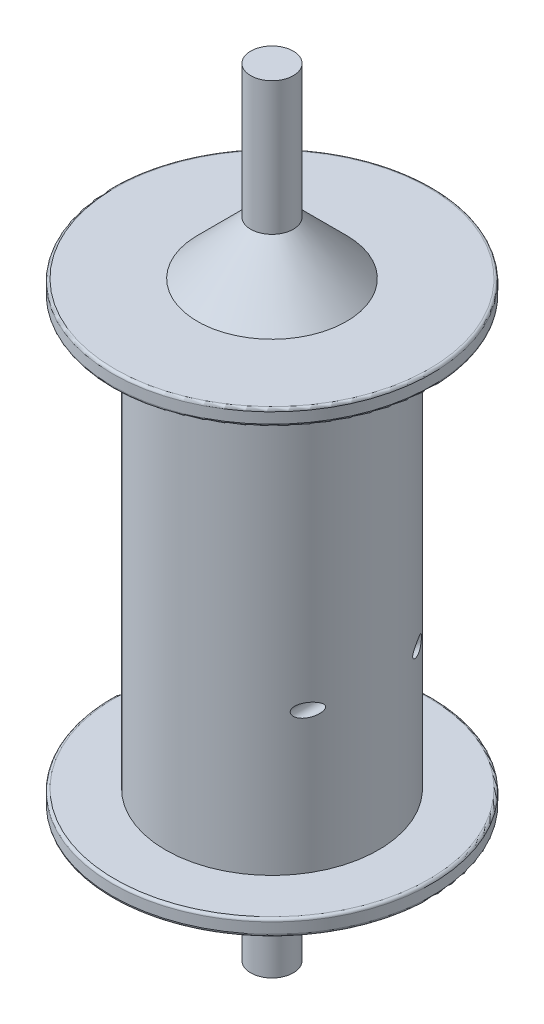
from build123d import *

# Parameters (mm, degrees)
SKETCH_1_R               = 20
EXTRUDE_1_DEPTH          = 80
SKETCH_2_R               = 30
EXTRUDE_2_DEPTH          = 3
EXTRUDE_START            = 3
SKETCH_3_R               = 30
EXTRUDE_3_DEPTH          = 3
CUT_EXTRUDE_1_DEPTH      = 94.214805691
CUT_EXTRUDE_1_DEPTH_BACK = 94.214805691
SKETCH_4_R               = 1.25
FILLET_1_R               = 0.5
SKETCH_5_R               = 4
EXTRUDE_4_DEPTH          = 35
EXTRUDE_START_2          = 25
SKETCH_6_R               = 4
EXTRUDE_5_DEPTH          = 25
CHAMFER_4_SIZE           = 10
CHAMFER_5_SIZE           = 10


with BuildPart() as part:
    # 草图1 → 凸台-拉伸1 (new body)
    with BuildSketch(Plane(origin=(0, 0, 0), x_dir=(1, 0, 0), z_dir=(0, 1, 0))):
        with Locations(Location((0, 0, 0), (0, 0, 270))):
            Circle(SKETCH_1_R)
    extrude(amount=EXTRUDE_1_DEPTH)

    # 草图2 → 凸台-拉伸2 (add)
    with BuildSketch(Plane(origin=(0, 80, 0), x_dir=(1, 0, 0), z_dir=(0, 1, 0))):
        with Locations(Location((0, 0, 0), (0, 0, 270))):
            Circle(SKETCH_2_R)
    extrude(amount=EXTRUDE_2_DEPTH)

    # 草图3 → 凸台-拉伸3 (add)
    with BuildSketch(Plane.XZ.offset(EXTRUDE_START)):
        with Locations(Location((0, 0, 0), (0, 0, 90))):
            Circle(SKETCH_3_R)
    extrude(amount=-EXTRUDE_3_DEPTH)

    # 草图4 → 切除-拉伸1 (cut, two sides: drawn at the far end of the back side and taken through both)
    with BuildSketch(Plane.XY.offset(-CUT_EXTRUDE_1_DEPTH_BACK)):
        with Locations((17, 26.5)):
            Circle(SKETCH_4_R)
    extrude(amount=CUT_EXTRUDE_1_DEPTH + CUT_EXTRUDE_1_DEPTH_BACK, mode=Mode.SUBTRACT)

    # 圆角1
    fillet_1_edges = [part.edges().sort_by_distance(p)[0] for p in [
        (0, 0, -30),
        (0, -3, -30),
        (0, 80, -30),
        (0, 83, -30),
    ]]
    fillet(fillet_1_edges, radius=FILLET_1_R)

    # 草图5 → 凸台-拉伸4 (add)
    with BuildSketch(Plane(origin=(0, 83, 0), x_dir=(1, 0, 0), z_dir=(0, 1, 0))):
        with Locations(Location((0, 0, 0), (0, 0, 270))):
            Circle(SKETCH_5_R)
    extrude(amount=EXTRUDE_4_DEPTH)

    # 草图6 → 凸台-拉伸5 (add)
    with BuildSketch(Plane(origin=(0, -3, 0), x_dir=(-1, 0, 0), z_dir=(0, -1, 0)).offset(EXTRUDE_START_2)):
        with Locations(Location((0, 0, 0), (0, 0, 270))):
            Circle(SKETCH_6_R)
    extrude(amount=-EXTRUDE_5_DEPTH)

    # 倒角4
    chamfer_4_edges = [part.edges().sort_by_distance(p)[0] for p in [
        (0, 83, -4),
    ]]
    chamfer(chamfer_4_edges, length=CHAMFER_4_SIZE)

    # 倒角5
    chamfer_5_edges = [part.edges().sort_by_distance(p)[0] for p in [
        (0, -3, -4),
    ]]
    chamfer(chamfer_5_edges, length=CHAMFER_5_SIZE)


solid = part.part
